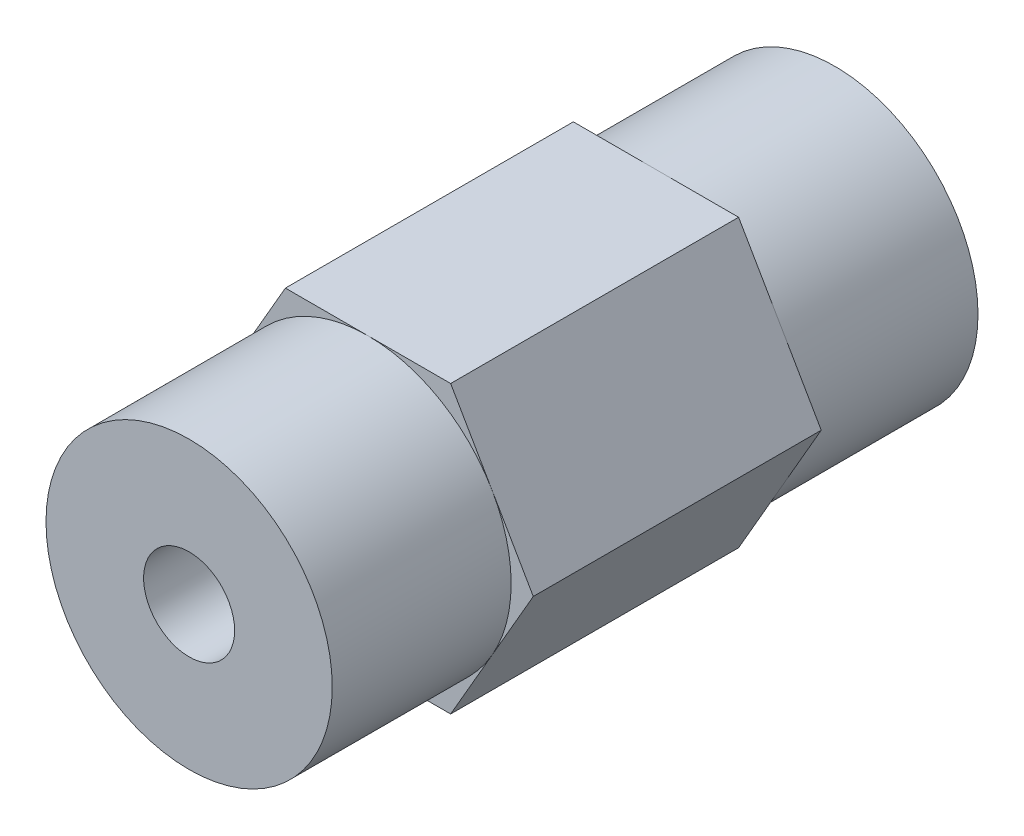
from build123d import *

# Parameters (mm, degrees)
SKETCH1_R                            = 2.0193
BOSS_EXTRUDE1_DEPTH                  = 14.3256
F_10_32_TAPPED_HOLE1_D               = 4.0386
F_10_32_TAPPED_HOLE1_DEPTH           = 11.938
F_10_32_TAPPED_HOLE1_TIP             = 1.213317848
F_10_32_TAPPED_HOLE1_ON_FACE_2_D     = 4.0386
F_10_32_TAPPED_HOLE1_ON_FACE_2_DEPTH = 11.938
F_10_32_TAPPED_HOLE1_ON_FACE_2_TIP   = 1.213317848
SKETCH4_R                            = 8.89
SKETCH4_R_2                          = 6.35
CUT_EXTRUDE_THIN1_DEPTH              = 7.9375


with BuildPart() as part:
    # Sketch1 → Boss-Extrude1 (new, symmetric)
    with BuildSketch(Plane.XY):
        Polygon((7.332348419, 0), (3.666174209, 6.35), (-3.666174209, 6.35), (-7.332348419, 0), (-3.666174209, -6.35), (3.666174209, -6.35), align=None)
        Circle(SKETCH1_R, mode=Mode.SUBTRACT)
    extrude(amount=BOSS_EXTRUDE1_DEPTH, both=True)

    # #10-32 Tapped Hole1
    with Locations(Plane.XY.offset(14.3256)):
        with Locations((0, 0)):
            Hole(F_10_32_TAPPED_HOLE1_D / 2, depth=F_10_32_TAPPED_HOLE1_DEPTH)
            with Locations((0, 0, -(F_10_32_TAPPED_HOLE1_DEPTH + F_10_32_TAPPED_HOLE1_TIP / 2))):  # 118° drill point
                Cone(0, F_10_32_TAPPED_HOLE1_D / 2, F_10_32_TAPPED_HOLE1_TIP, mode=Mode.SUBTRACT)

    # #10-32 Tapped Hole1 on face 2
    with Locations(Plane.XY.offset(-14.3256)):
        with Locations((0, 0)):
            Hole(F_10_32_TAPPED_HOLE1_ON_FACE_2_D / 2, depth=F_10_32_TAPPED_HOLE1_ON_FACE_2_DEPTH)
            with Locations((0, 0, -(F_10_32_TAPPED_HOLE1_ON_FACE_2_DEPTH + F_10_32_TAPPED_HOLE1_ON_FACE_2_TIP / 2))):  # 118° drill point
                Cone(0, F_10_32_TAPPED_HOLE1_ON_FACE_2_D / 2, F_10_32_TAPPED_HOLE1_ON_FACE_2_TIP, mode=Mode.SUBTRACT)

    # Sketch4 → Cut-Extrude-Thin1 (cut)
    with BuildSketch(Plane.XY.offset(14.3256)):
        Circle(SKETCH4_R)
        Circle(SKETCH4_R_2, mode=Mode.SUBTRACT)
    cut_extrude_thin1 = extrude(amount=-CUT_EXTRUDE_THIN1_DEPTH, mode=Mode.SUBTRACT)

    # Mirror1: Cut-Extrude-Thin1 across plane
    add(cut_extrude_thin1.mirror(Plane.XY), mode=Mode.SUBTRACT)


solid = part.part
